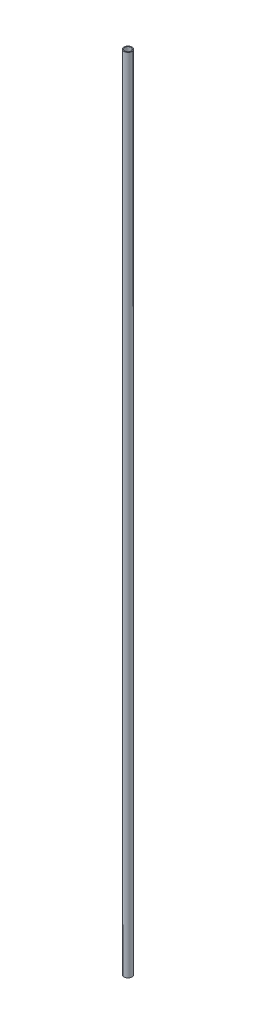
from build123d import *

# Parameters (mm, degrees)
CROQUIS1_R              = 5
CROQUIS1_R_2            = 4
SALIENTE_EXTRUIR1_DEPTH = 1020


with BuildPart() as part:
    # Croquis1 → Saliente-Extruir1 (new body)
    with BuildSketch(Plane(origin=(0, 0, 0), x_dir=(1, 0, 0), z_dir=(0, 1, 0))):
        with Locations(Location((0, 0, 0), (0, 0, 270))):
            Circle(CROQUIS1_R)
        with Locations(Location((0, 0, 0), (0, 0, 270))):
            Circle(CROQUIS1_R_2, mode=Mode.SUBTRACT)
    extrude(amount=SALIENTE_EXTRUIR1_DEPTH)


solid = part.part
